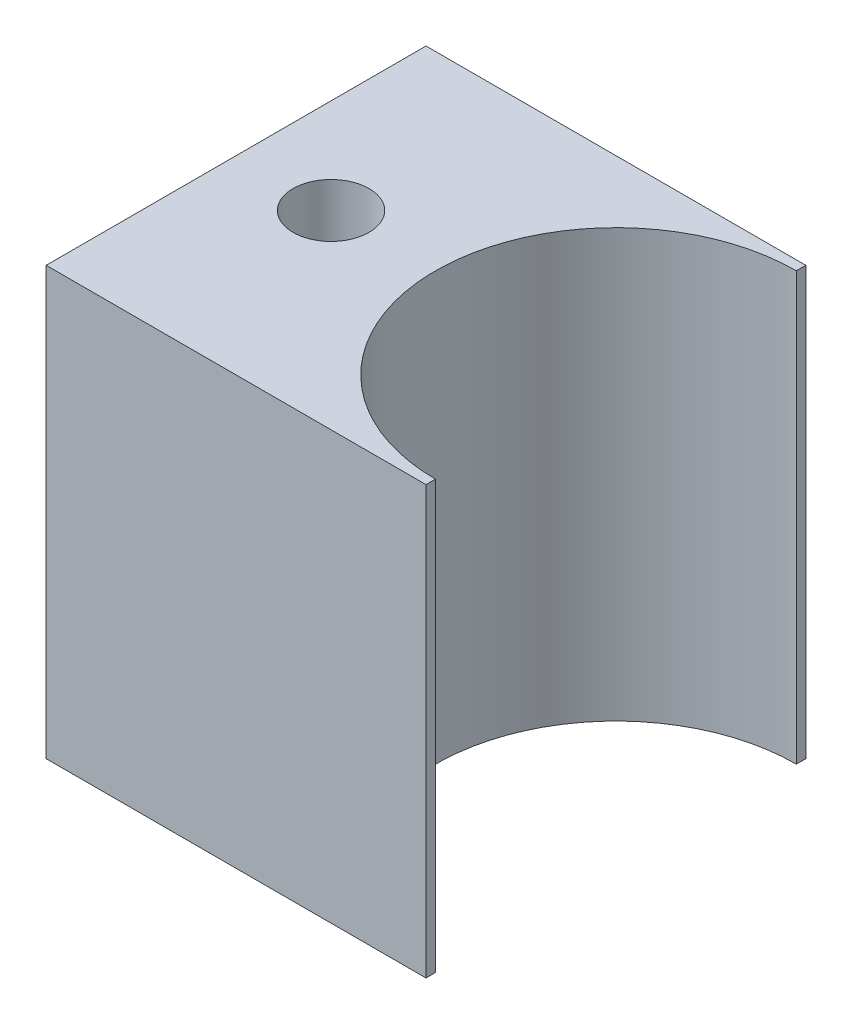
from build123d import *

# Parameters (mm, degrees)
BOSS_EXTRUDE1_DEPTH = 28.575
SKETCH6_R           = 2.54
CUT_EXTRUDE4_DEPTH  = 28.575


with BuildPart() as part:
    # Sketch3 → Boss-Extrude1 (new body)
    with BuildSketch(Plane(origin=(0, 0, 0), x_dir=(1, 0, 0), z_dir=(0, 1, 0))):
        with BuildLine():
            Line((0, 0), (0, 0.635))
            ThreePointArc((0, 0.635), (-12.065, 12.7), (0, 24.765))
            Line((0, 24.765), (0, 25.4))
            Line((0, 25.4), (-25.4, 25.4))
            Line((-25.4, 25.4), (-25.4, 0))
            Line((-25.4, 0), (0, 0))
        make_face()
    extrude(amount=BOSS_EXTRUDE1_DEPTH)

    # Sketch6 → Cut-Extrude4 (cut)
    with BuildSketch(Plane(origin=(0, 0, 0), x_dir=(-1, 0, 0), z_dir=(0, -1, 0))):
        with Locations(Location((19.05, 12.7, 0), (0, 0, 90))):
            Circle(SKETCH6_R)
    extrude(amount=-CUT_EXTRUDE4_DEPTH, mode=Mode.SUBTRACT)


solid = part.part
